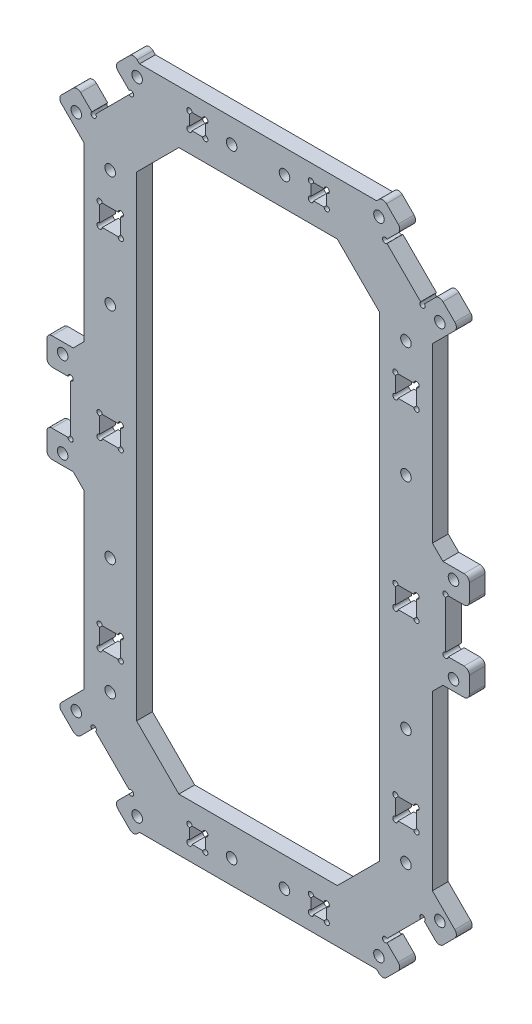
from build123d import *

# Parameters (mm, degrees)
SKETCH1_R           = 1
BOSS_EXTRUDE1_DEPTH = 3
CHAMFER1_SIZE       = 8
FILLET1_R           = 1
CHAMFER2_SIZE       = 2


with BuildPart() as part:
    # Sketch1 → Boss-Extrude1 (new body)
    with BuildSketch(Plane.XY):
        with BuildLine():
            Line((10.550497979, 51.377132485), (-11.890966705, 51.377132485))
            Line((-11.890966705, 51.377132485), (-11.890966705, 46.877132485))
            Line((-11.890966705, 46.877132485), (-11.890966705, 41.377132485))
            Line((-11.890966705, 41.377132485), (11.109033295, 41.377132485))
            Line((11.109033295, 41.377132485), (11.109033295, -11.622867515))
            Line((11.109033295, -11.622867515), (14.109033295, -11.622867515))
            Line((14.109033295, -11.622867515), (14.109033295, -10.122867515))
            ThreePointArc((14.109033295, -10.122867515), (13.755479904, -9.269314124), (14.609033295, -9.622867515))
            Line((14.609033295, -9.622867515), (17.609033295, -9.622867515))
            ThreePointArc((17.609033295, -9.622867515), (18.462586685, -9.269314124), (18.109033295, -10.122867515))
            Line((18.109033295, -10.122867515), (18.109033295, -11.622867515))
            Line((18.109033295, -11.622867515), (23.609033295, -11.622867515))
            Line((23.609033295, -11.622867515), (23.609033295, -7.122867515))
            ThreePointArc((23.609033295, -7.122867515), (23.255479904, -6.269314124), (24.109033295, -6.622867515))
            Line((24.109033295, -6.622867515), (28.109033295, -6.622867515))
            Line((28.109033295, -6.622867515), (28.109033295, -1.472867515))
            Line((28.109033295, -1.472867515), (21.109033295, -1.472867515))
            Line((21.109033295, -1.472867515), (21.109033295, 33.227132485))
            Line((21.109033295, 33.227132485), (26.058780763, 38.176879953))
            Line((26.058780763, 38.176879953), (22.41718084, 41.818479876))
            Line((22.41718084, 41.818479876), (19.588753715, 38.990052752))
            ThreePointArc((19.588753715, 38.990052752), (19.235200325, 38.136499361), (18.881646934, 38.990052752))
            Line((18.881646934, 38.990052752), (12.517685903, 45.354013782))
            ThreePointArc((12.517685903, 45.354013782), (11.664132513, 45.707567173), (12.517685903, 46.061120563))
            Line((12.517685903, 46.061120563), (15.346113028, 48.889547688))
            Line((15.346113028, 48.889547688), (11.704513105, 52.531147611))
            Line((11.704513105, 52.531147611), (10.550497979, 51.377132485))
        make_face()
        with Locations((25.109033295, -3.472867515)):
            Circle(SKETCH1_R, mode=Mode.SUBTRACT)
        with Locations((16.109033295, 9.167132485)):
            Circle(SKETCH1_R, mode=Mode.SUBTRACT)
        with BuildLine():
            ThreePointArc((-5.890966705, 46.877132485), (-6.890966705, 45.877132485), (-7.890966705, 46.877132485))
            ThreePointArc((-7.890966705, 46.877132485), (-6.890966705, 47.877132485), (-5.890966705, 46.877132485))
        make_face(mode=Mode.SUBTRACT)
        with BuildLine():
            Line((-1.890966705, 45.877132485), (-1.890966705, 46.877132485))
            Line((-1.890966705, 46.877132485), (-1.890966705, 47.877132485))
            ThreePointArc((-1.890966705, 47.877132485), (-2.244520096, 48.730685876), (-1.390966705, 48.377132485))
            Line((-1.390966705, 48.377132485), (0.609033295, 48.377132485))
            ThreePointArc((0.609033295, 48.377132485), (1.462586685, 48.730685876), (1.109033295, 47.877132485))
            Line((1.109033295, 47.877132485), (1.109033295, 45.877132485))
            ThreePointArc((1.109033295, 45.877132485), (1.462586685, 45.023579094), (0.609033295, 45.377132485))
            Line((0.609033295, 45.377132485), (-1.390966705, 45.377132485))
            ThreePointArc((-1.390966705, 45.377132485), (-2.244520096, 45.023579094), (-1.890966705, 45.877132485))
        make_face(mode=Mode.SUBTRACT)
        with BuildLine():
            ThreePointArc((14.109033295, 24.527132485), (13.755479904, 25.380685876), (14.609033295, 25.027132485))
            Line((14.609033295, 25.027132485), (17.609033295, 25.027132485))
            ThreePointArc((17.609033295, 25.027132485), (18.462586685, 25.380685876), (18.109033295, 24.527132485))
            Line((18.109033295, 24.527132485), (18.109033295, 21.527132485))
            ThreePointArc((18.109033295, 21.527132485), (18.462586685, 20.673579094), (17.609033295, 21.027132485))
            Line((17.609033295, 21.027132485), (14.609033295, 21.027132485))
            ThreePointArc((14.609033295, 21.027132485), (13.755479904, 20.673579094), (14.109033295, 21.527132485))
            Line((14.109033295, 21.527132485), (14.109033295, 24.527132485))
        make_face(mode=Mode.SUBTRACT)
        with Locations((16.109033295, 31.167132485)):
            Circle(SKETCH1_R, mode=Mode.SUBTRACT)
        with Locations((10.997406324, 48.995613705)):
            Circle(SKETCH1_R, mode=Mode.SUBTRACT)
        with Locations((22.523246857, 37.469773172)):
            Circle(SKETCH1_R, mode=Mode.SUBTRACT)
    extrude(amount=BOSS_EXTRUDE1_DEPTH)

    # Chamfer1
    chamfer1_edges = [part.edges().sort_by_distance(p)[0] for p in [
        (11.109033295, 41.377132485, 1.5),
    ]]
    chamfer(chamfer1_edges, length=CHAMFER1_SIZE)

    # Fillet1
    fillet1_edges = [part.edges().sort_by_distance(p)[0] for p in [
        (22.41718084, 41.818479876, 1.5),
        (26.058780763, 38.176879953, 1.5),
        (28.109033295, -1.472867515, 1.5),
        (28.109033295, -6.622867515, 1.5),
        (11.704513105, 52.531147611, 1.5),
        (15.346113028, 48.889547688, 1.5),
    ]]
    fillet(fillet1_edges, radius=FILLET1_R)

    # Chamfer2
    chamfer2_edges = [part.edges().sort_by_distance(p)[0] for p in [
        (21.109033295, -1.472867515, 1.5),
    ]]
    chamfer(chamfer2_edges, length=CHAMFER2_SIZE)

    # Mirror1: part across plane


with BuildPart() as part_1:
    add(part.part)
    add(part.part.mirror(Plane(origin=(0, -11.622867515, 3), x_dir=(0, 0, 1), z_dir=(0, -1, 0))))

    # Mirror2: part across plane


with BuildPart() as part_2:
    add(part_1.part)
    add(part_1.part.mirror(Plane(origin=(-11.890966705, 0, 3), x_dir=(0, 0, 1), z_dir=(1, 0, 0))))


solid = part_2.part
